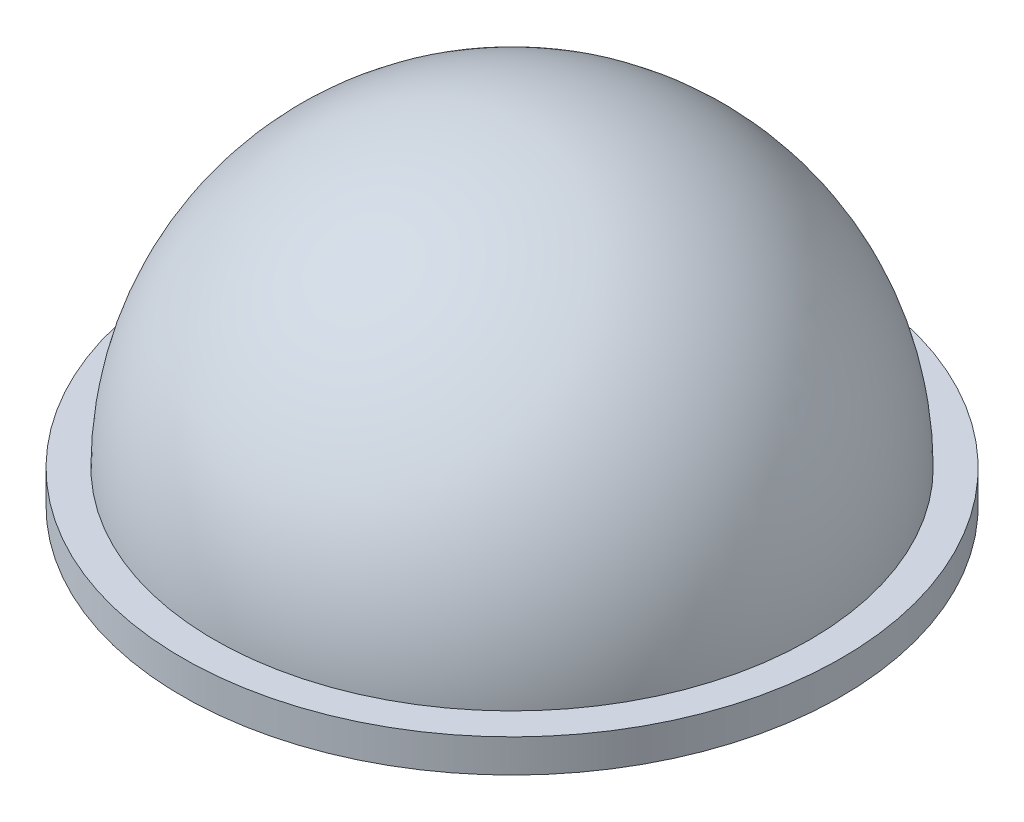
from build123d import *


with BuildPart() as part:
    # 草图1 → 旋转1 (revolve)
    with BuildSketch(Plane.XY):
        with BuildLine():
            Line((45, 0), (49.8, 0))
            Line((49.8, 0), (49.8, -5))
            Line((49.8, -5), (40, -5))
            Line((40, -5), (40, 0))
            ThreePointArc((40, 0), (28.284271247, 28.284271247), (0, 40))
            Line((0, 40), (0, 45))
            ThreePointArc((0, 45), (31.819805153, 31.819805153), (45, 0))
        make_face()
    revolve(axis=Axis((0, 0, 0), (0, 1, 0)))


solid = part.part
